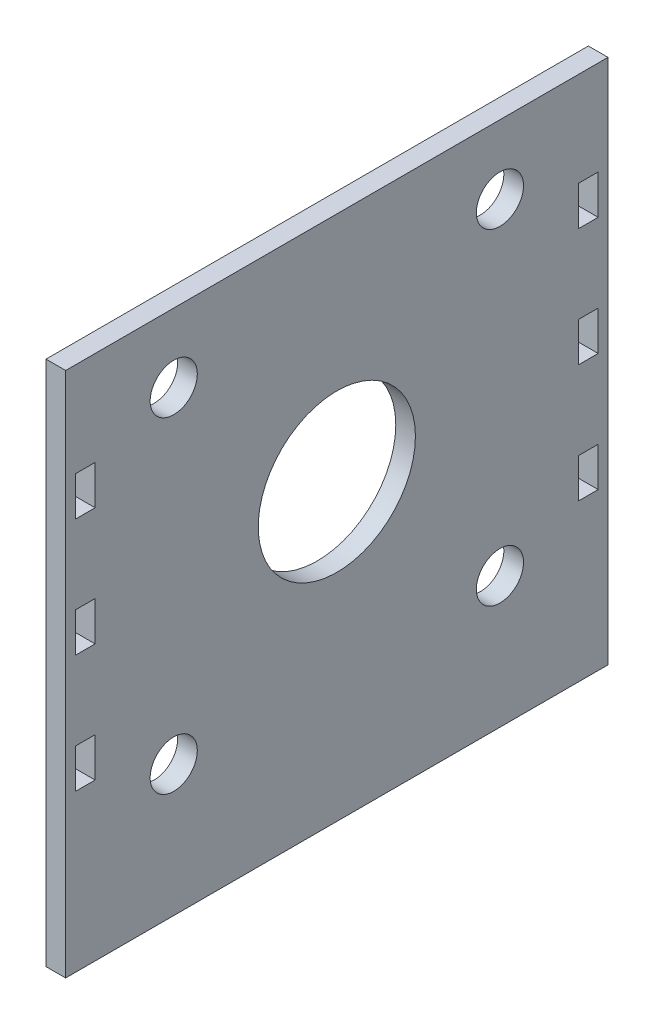
from build123d import *

# Parameters (mm, degrees)
SKETCH4_R           = 6
SKETCH4_R_2         = 20
SKETCH4_W           = 5
SKETCH4_H           = 9.999474932
BOSS_EXTRUDE2_DEPTH = 5


with BuildPart() as part:
    # Sketch4 → Boss-Extrude2 (new body)
    with BuildSketch(Plane(origin=(0, 0, 0), x_dir=(0, 0, -1), z_dir=(1, 0, 0))):
        Polygon((-59, 59), (59, 59), (69, 59), (69, -59), (69, -74.875), (-69, -74.875), (-69, -59), (-69, 59), align=None)
        with Locations((41.5, 41.5)):
            Circle(SKETCH4_R, mode=Mode.SUBTRACT)
        with Locations((41.5, -41.5)):
            Circle(SKETCH4_R, mode=Mode.SUBTRACT)
        with Locations((-41.5, 41.5)):
            Circle(SKETCH4_R, mode=Mode.SUBTRACT)
        with Locations((-41.5, -41.5)):
            Circle(SKETCH4_R, mode=Mode.SUBTRACT)
        Circle(SKETCH4_R_2, mode=Mode.SUBTRACT)
        with Locations((-64, 0)):
            Rectangle(SKETCH4_W, SKETCH4_H, mode=Mode.SUBTRACT)
        with Locations((-64, 30)):
            Rectangle(SKETCH4_W, SKETCH4_H, mode=Mode.SUBTRACT)
        with Locations((-64, -30)):
            Rectangle(SKETCH4_W, SKETCH4_H, mode=Mode.SUBTRACT)
        with Locations((64, 30)):
            Rectangle(SKETCH4_W, SKETCH4_H, mode=Mode.SUBTRACT)
        with Locations((64, 0)):
            Rectangle(SKETCH4_W, SKETCH4_H, mode=Mode.SUBTRACT)
        with Locations((64, -30)):
            Rectangle(SKETCH4_W, SKETCH4_H, mode=Mode.SUBTRACT)
    extrude(amount=BOSS_EXTRUDE2_DEPTH)


solid = part.part
